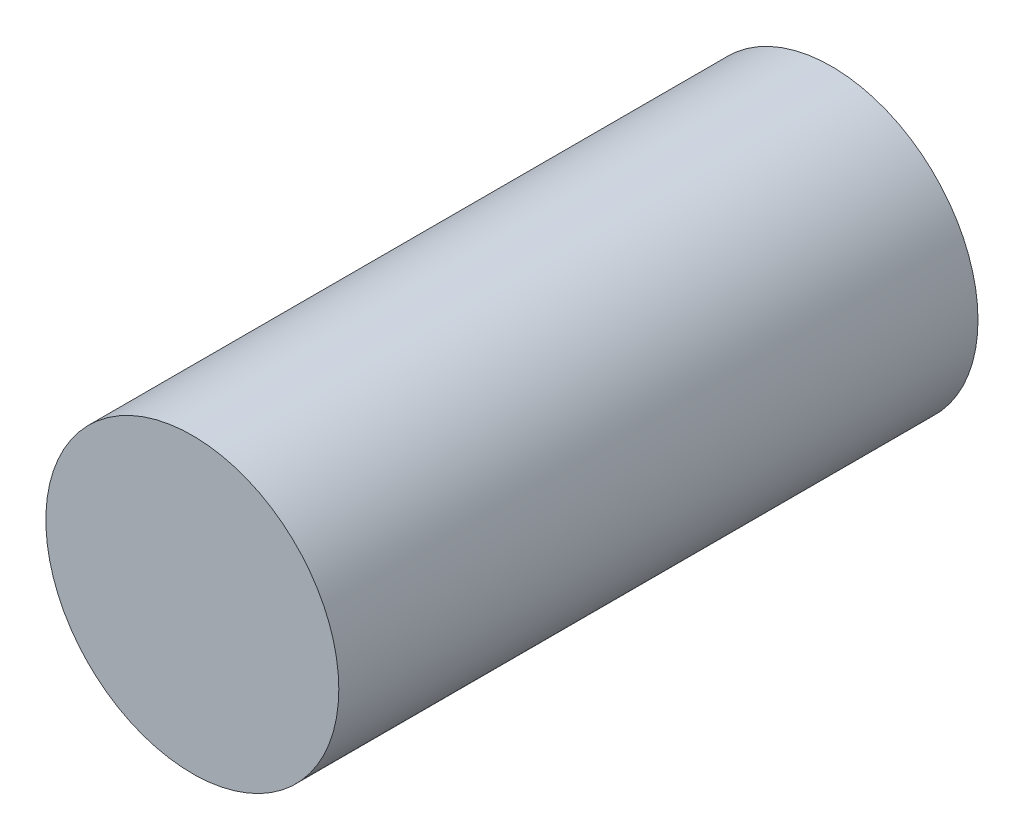
from build123d import *

# Parameters (mm, degrees)
ESQUISSE1_R      = 5.5
EXTRUSION1_DEPTH = 24


with BuildPart() as part:
    # Esquisse1 → Extrusion1 (new body)
    with BuildSketch(Plane.XY):
        Circle(ESQUISSE1_R)
    extrude(amount=EXTRUSION1_DEPTH)


solid = part.part
